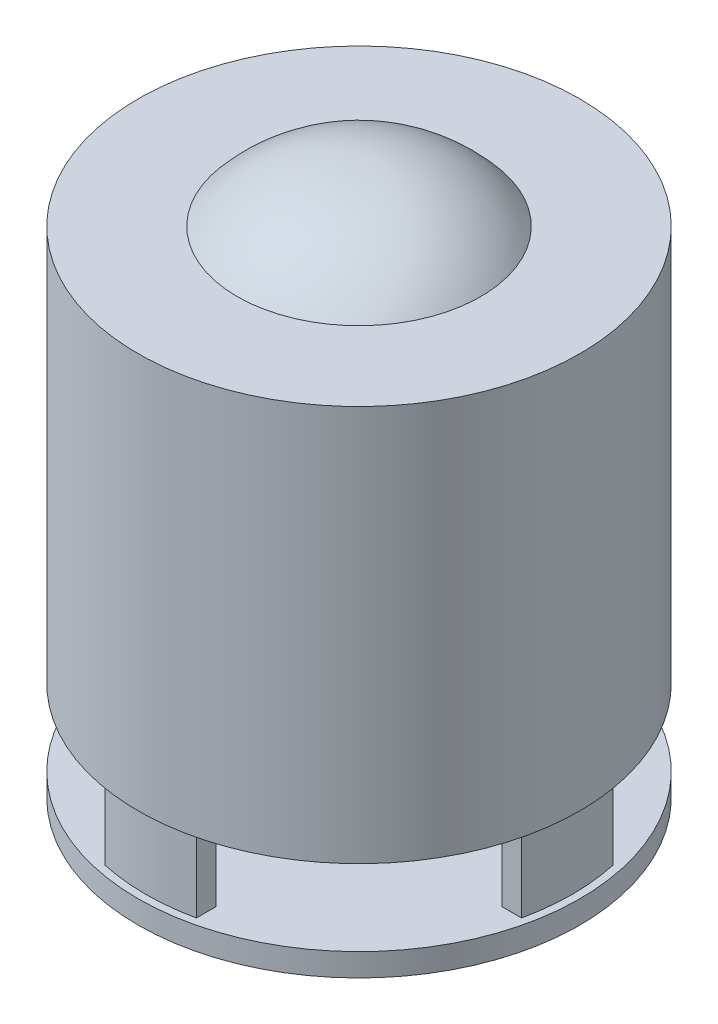
from build123d import *

# Parameters (mm, degrees)
SKETCH1_R           = 29
BOSS_EXTRUDE1_DEPTH = 3
BOSS_EXTRUDE2_DEPTH = 10
SKETCH3_R           = 29
BOSS_EXTRUDE3_DEPTH = 52
SKETCH5_R           = 2.05
CUT_EXTRUDE1_DEPTH  = 5


with BuildPart() as part:
    # Sketch1 → Boss-Extrude1 (new body)
    with BuildSketch(Plane(origin=(0, 0, 0), x_dir=(1, 0, 0), z_dir=(0, 1, 0))):
        with Locations(Location((0, 0, 0), (0, 0, 270))):
            Circle(SKETCH1_R)
    extrude(amount=BOSS_EXTRUDE1_DEPTH)

    # Sketch2 → Boss-Extrude2 (add)
    with BuildSketch(Plane(origin=(0, 3, 0), x_dir=(1, 0, 0), z_dir=(0, 1, 0))):
        with BuildLine():
            ThreePointArc((-27.349588662, 6), (-28, 0), (-27.349588662, -6))
            Line((-27.349588662, -6), (-24.784067463, -6))
            ThreePointArc((-24.784067463, -6), (-25.5, 0), (-24.784067463, 6))
            Line((-24.784067463, 6), (-27.349588662, 6))
        make_face()
        with BuildLine():
            Line((24.784067463, -6), (27.349588662, -6))
            ThreePointArc((27.349588662, -6), (27.836922267, -3.017574975), (28, 0))
            ThreePointArc((28, 0), (27.836922267, 3.017574975), (27.349588662, 6))
            Line((27.349588662, 6), (24.784067463, 6))
            ThreePointArc((24.784067463, 6), (25.320384281, 3.02128116), (25.5, 0))
            ThreePointArc((25.5, 0), (25.320384281, -3.02128116), (24.784067463, -6))
        make_face()
        with BuildLine():
            Line((-6, -24.784067463), (-6, -27.349588662))
            ThreePointArc((-6, -27.349588662), (0, -28), (6, -27.349588662))
            Line((6, -27.349588662), (6, -24.784067463))
            ThreePointArc((6, -24.784067463), (0, -25.5), (-6, -24.784067463))
        make_face()
        with BuildLine():
            ThreePointArc((6, 27.349588662), (0, 28), (-6, 27.349588662))
            Line((-6, 27.349588662), (-6, 24.784067463))
            ThreePointArc((-6, 24.784067463), (0, 25.5), (6, 24.784067463))
            Line((6, 24.784067463), (6, 27.349588662))
        make_face()
    extrude(amount=BOSS_EXTRUDE2_DEPTH)

    # Sketch3 → Boss-Extrude3 (add)
    with BuildSketch(Plane(origin=(0, 13, 0), x_dir=(1, 0, 0), z_dir=(0, 1, 0))):
        with Locations(Location((0, 0, 0), (0, 0, 270))):
            Circle(SKETCH3_R)
    extrude(amount=BOSS_EXTRUDE3_DEPTH)

    # Sketch4 → Revolve1 (revolve)
    with BuildSketch(Plane.XY, mode=Mode.PRIVATE) as revolve1_sk:
        with BuildLine():
            Line((0, 65), (0, 72))
            ThreePointArc((0, 72), (8.804421669, 70.338678101), (16, 65))
            Line((16, 65), (0, 65))
        make_face()
    revolve(revolve1_sk.sketch.rotate(Axis((0, 65, 0), (0, 1, 0)), 90), axis=Axis((0, 65, 0), (0, 1, 0)))

    # Sketch5 → Cut-Extrude1 (cut)
    with BuildSketch(Plane.XZ):
        with Locations(Location((0, 12, 0), (0, 0, 270))):
            Circle(SKETCH5_R)
        with Locations(Location((10.392304845, -6, 0), (0, 0, 270))):
            Circle(SKETCH5_R)
        with Locations(Location((-10.392304845, -6, 0), (0, 0, 270))):
            Circle(SKETCH5_R)
    extrude(amount=-CUT_EXTRUDE1_DEPTH, mode=Mode.SUBTRACT)


solid = part.part
